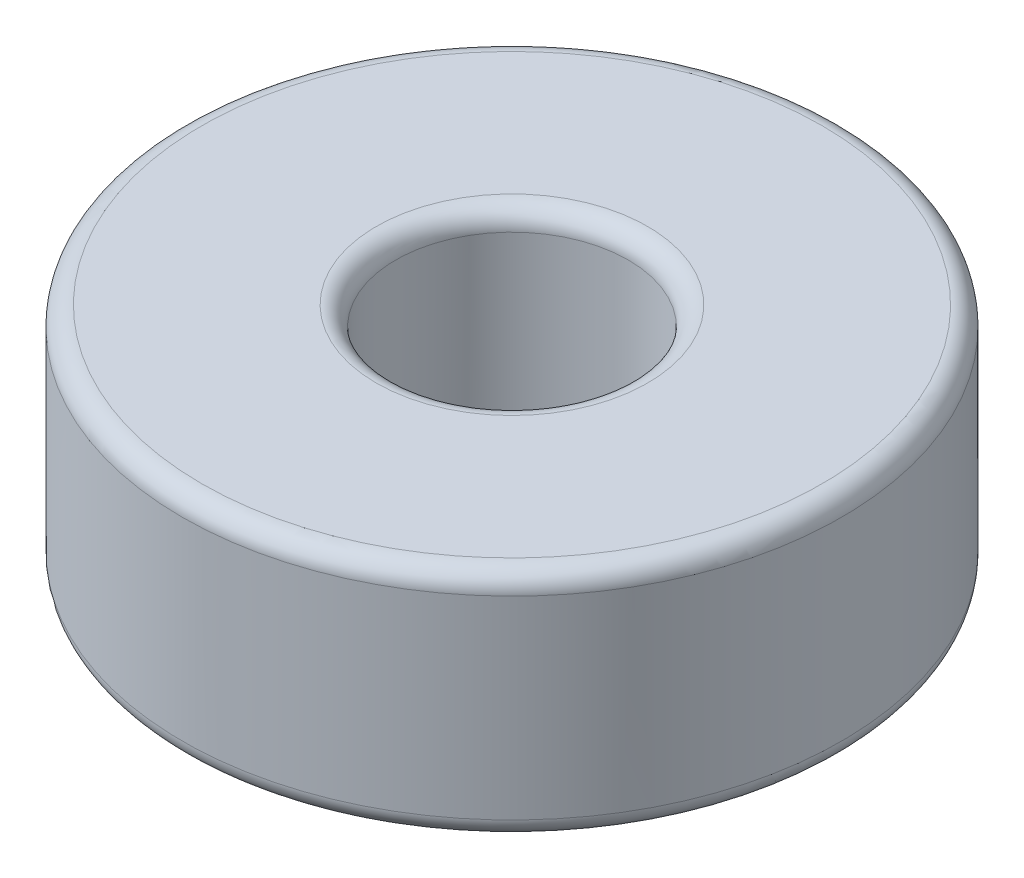
from build123d import *

# Parameters (mm, degrees)
ESQUISSE1_W = 5.5
ESQUISSE1_H = 6
CONG_1_R    = 0.5


with BuildPart() as part:
    # Esquisse1 → Révolution1 (revolve)
    with BuildSketch(Plane.XY, mode=Mode.PRIVATE) as r_volution1_sk:
        with Locations((5.75, 3)):
            Rectangle(ESQUISSE1_W, ESQUISSE1_H)
    revolve(r_volution1_sk.sketch.rotate(Axis((0, 0, 0), (0, 1, 0)), 90), axis=Axis((0, 0, 0), (0, 1, 0)))

    # Congé1
    cong_1_edges = [part.edges().sort_by_distance(p)[0] for p in [
        (0, 6, 3),
        (0, 6, 8.5),
        (0, 0, 8.5),
        (0, 0, 3),
    ]]
    fillet(cong_1_edges, radius=CONG_1_R)


solid = part.part
